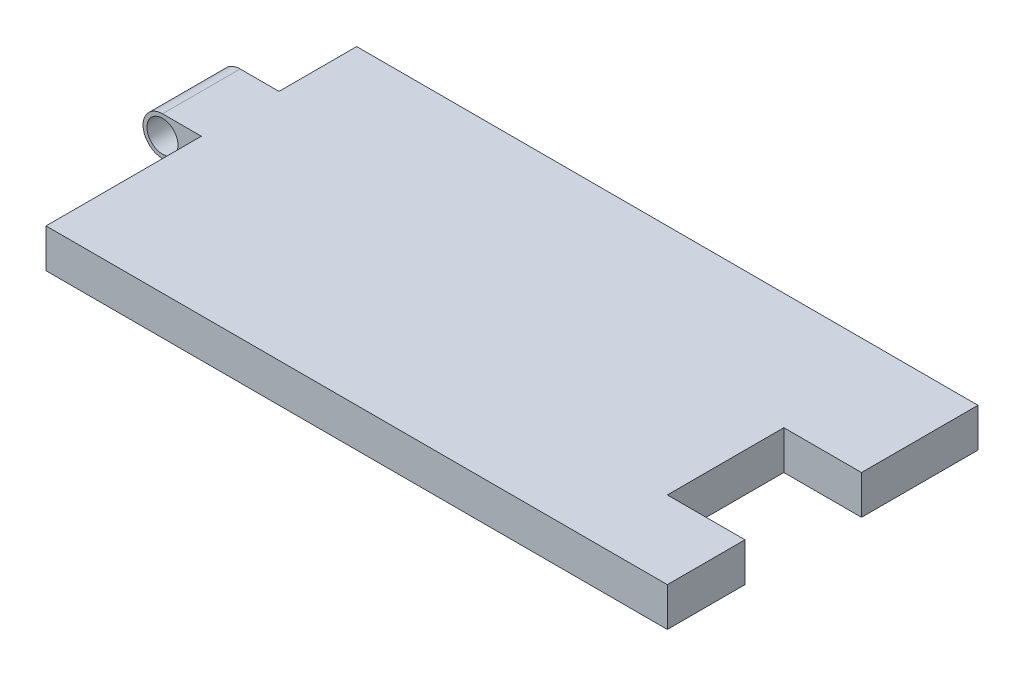
from build123d import *

# Parameters (mm, degrees)
BASE_DEPTH         = 5
BASE_DEPTH_BACK    = 5
ESQUISSE1_R        = 2
ESQUISSE2_W        = 75
ESQUISSE2_H        = 5
BOSS_GRAND_DEPTH   = 10
ESQUISSE3_W        = 75
ESQUISSE3_H        = 5
BOSS_PETIT_DEPTH   = 10
ESQUISSE4_W        = 5
ESQUISSE4_H        = 15
BLOQUER_DEPTH      = 5
ESQUISSE5_W        = 5
ESQUISSE5_H        = 15
VIDE_BLOQUER_DEPTH = 5
ESQUISSE6_W        = 80
ESQUISSE6_H        = 5
BOSSE_BAS_DEPTH    = 10
ESQUISSE7_R        = 2
BOSS_EXTRU_6_DEPTH = 5


with BuildPart() as part:
    # Esquisse1 → BASE (new, two sides: drawn at the far end of the back side and taken through both)
    with BuildSketch(Plane.XY.offset(-BASE_DEPTH_BACK)):
        with BuildLine():
            Line((-80, 2.5), (0, 2.5))
            Line((0, 2.5), (0, -2.5))
            Line((0, -2.5), (-80, -2.5))
            ThreePointArc((-80, -2.5), (-82.5, 0), (-80, 2.5))
        make_face()
        with Locations((-80, 0)):
            Circle(ESQUISSE1_R, mode=Mode.SUBTRACT)
    extrude(amount=BASE_DEPTH + BASE_DEPTH_BACK)

    # Esquisse2 → BOSS GRAND (add)
    with BuildSketch(Plane.XY.offset(5)):
        with Locations((-37.5, 0)):
            Rectangle(ESQUISSE2_W, ESQUISSE2_H)
    extrude(amount=BOSS_GRAND_DEPTH)

    # Esquisse3 → BOSS PETIT (add)
    with BuildSketch(Plane(origin=(0, 0, -5), x_dir=(-1, 0, 0), z_dir=(0, 0, -1))):
        with Locations((37.5, 0)):
            Rectangle(ESQUISSE3_W, ESQUISSE3_H)
    extrude(amount=BOSS_PETIT_DEPTH)

    # Esquisse4 → BLOQUER (add)
    with BuildSketch(Plane(origin=(0, 2.5, 0), x_dir=(1, 0, 0), z_dir=(0, 1, 0))):
        with Locations((2.5, 7.5)):
            Rectangle(ESQUISSE4_W, ESQUISSE4_H)
    extrude(amount=-BLOQUER_DEPTH)

    # Esquisse5 → VIDE BLOQUER (cut)
    with BuildSketch(Plane(origin=(0, 2.5, 0), x_dir=(1, 0, 0), z_dir=(0, 1, 0))):
        with Locations((-2.5, -7.5)):
            Rectangle(ESQUISSE5_W, ESQUISSE5_H)
    extrude(amount=-VIDE_BLOQUER_DEPTH, mode=Mode.SUBTRACT)

    # Esquisse6 → BOSSE BAS (add)
    with BuildSketch(Plane.XY.offset(15)):
        with Locations((-35, 0)):
            Rectangle(ESQUISSE6_W, ESQUISSE6_H)
    extrude(amount=BOSSE_BAS_DEPTH)

    # Esquisse7 → Boss.-Extru.6 (add)
    with BuildSketch(Plane.XZ.offset(2.5)):
        with Locations((-10, -10)):
            Circle(ESQUISSE7_R)
    extrude(amount=BOSS_EXTRU_6_DEPTH)


solid = part.part
